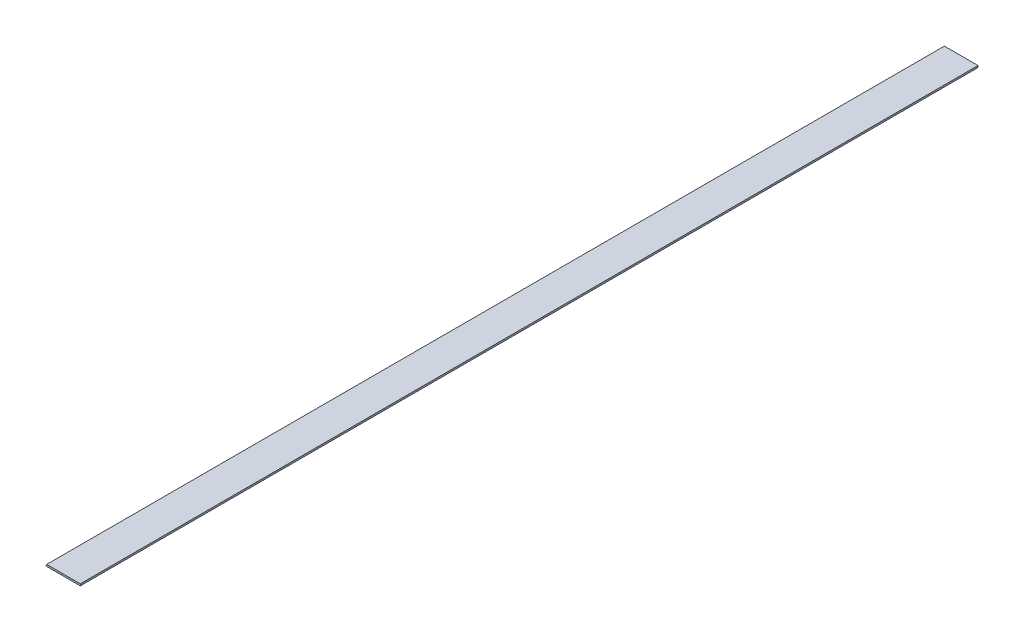
from build123d import *

# Parameters (mm, degrees)
BOSS_EXTRUDE1_DEPTH = 502


with BuildPart() as part:
    # Sketch1 → Boss-Extrude1 (new body)
    with BuildSketch(Plane.XY):
        Polygon((20.191747974, 1), (1.381747974, 1), (1, 0), (20.191747974, 0), align=None)
    extrude(amount=BOSS_EXTRUDE1_DEPTH)


solid = part.part
